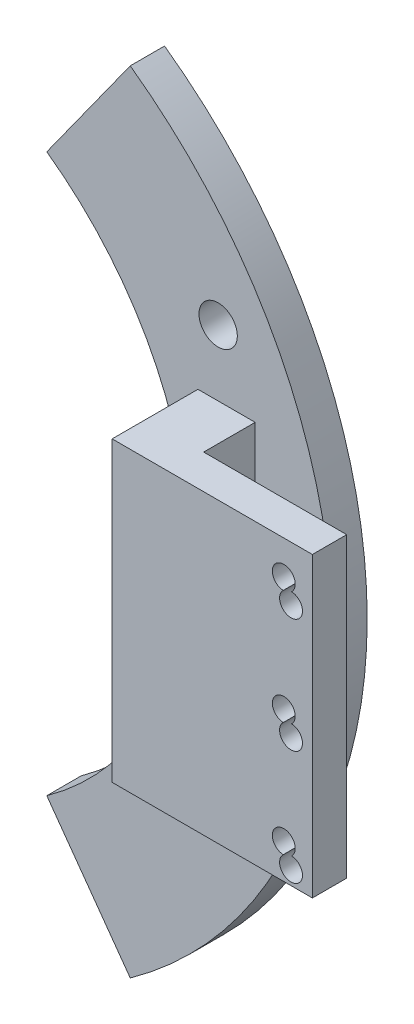
from build123d import *

# Parameters (mm, degrees)
SKETCH_1_R          = 85
SKETCH_1_R_2        = 60
EXTRUDE_1_DEPTH     = 6
SKETCH_2_R          = 3.35
CUT_EXTRUDE_1_DEPTH = 10
SKETCH_3_W          = 10
SKETCH_3_H          = 52
EXTRUDE_2_DEPTH     = 15
SKETCH_8_W          = 8
SKETCH_8_H          = 52
EXTRUDE_3_DEPTH     = 25
SKETCH_10_W         = 6
SKETCH_10_H         = 52
EXTRUDE_4_DEPTH     = 25
SKETCH_11_R         = 2
CUT_EXTRUDE_3_DEPTH = 25
CUT_EXTRUDE_4_DEPTH = 50
SKETCH_6_R          = 2
CUT_EXTRUDE_2_DEPTH = 20


with BuildPart() as part:
    # 草图1 → 凸台-拉伸1 (new body)
    with BuildSketch(Plane.XY):
        Circle(SKETCH_1_R)
        Circle(SKETCH_1_R_2, mode=Mode.SUBTRACT)
    extrude(amount=EXTRUDE_1_DEPTH)

    # 草图2 → 切除-拉伸1 (cut)
    with BuildSketch(Plane.XY.offset(6)):
        with Locations((0, 75)):
            Circle(SKETCH_2_R)
        with Locations((64.951905284, 37.5)):
            Circle(SKETCH_2_R)
        with Locations((64.951905284, -37.5)):
            Circle(SKETCH_2_R)
        with Locations((0, -75)):
            Circle(SKETCH_2_R)
        with Locations((-64.951905284, -37.5)):
            Circle(SKETCH_2_R)
        with Locations((-64.951905284, 37.5)):
            Circle(SKETCH_2_R)
    extrude(amount=-CUT_EXTRUDE_1_DEPTH, mode=Mode.SUBTRACT)

    # 草图3 → 凸台-拉伸2 (add)
    with BuildSketch(Plane.XY.offset(6)):
        with Locations((66.419532829, -0.009729533)):
            Rectangle(SKETCH_3_W, SKETCH_3_H)
        with Locations((-66.419532829, -0.009729533)):
            Rectangle(SKETCH_3_W, SKETCH_3_H)
    extrude(amount=EXTRUDE_2_DEPTH)

    # 草图8 → 凸台-拉伸3 (add)
    with BuildSketch(Plane.ZY.offset(71.419532829)):
        with Locations((17, -0.009729533)):
            Rectangle(SKETCH_8_W, SKETCH_8_H)
    extrude(amount=EXTRUDE_3_DEPTH)

    # 草图10 → 凸台-拉伸4 (add)
    with BuildSketch(Plane(origin=(71.419532829, 0, 0), x_dir=(0, 0, -1), z_dir=(1, 0, 0))):
        with Locations((-18, -0.009729533)):
            Rectangle(SKETCH_10_W, SKETCH_10_H)
    extrude(amount=EXTRUDE_4_DEPTH)

    # 草图11 → 切除-拉伸3 (cut)
    with BuildSketch(Plane.XY.offset(21)):
        with Locations((-91.419532829, 0)):
            Circle(SKETCH_11_R)
        with Locations((-91.419532829, 20)):
            Circle(SKETCH_11_R)
        with Locations(Location((91.419532829, 0, 0), (0, 0, 270))):
            Circle(SKETCH_11_R)
        with Locations(Location((91.419532829, 20, 0), (0, 0, 270))):
            Circle(SKETCH_11_R)
        with Locations((91.419532829, -20)):
            Circle(SKETCH_11_R)
        with Locations(Location((-91.419532829, -20, 0), (0, 0, 270))):
            Circle(SKETCH_11_R)
    extrude(amount=-CUT_EXTRUDE_3_DEPTH, mode=Mode.SUBTRACT)

    # 草图12 → 切除-拉伸4 (cut, symmetric)
    with BuildSketch(Plane.XY.offset(6)):
        with BuildLine():
            Line((35, 48.733971724), (49.583333333, 69.039793276))
            ThreePointArc((49.583333333, 69.039793276), (42.500689847, 73.611761034), (35, 77.459666924))
            Line((35, 77.459666924), (35, 90))
            Line((35, 90), (-35, 90))
            Line((-35, 90), (-133.620495243, 90))
            Line((-133.620495243, 90), (-133.620495243, -90))
            Line((-133.620495243, -90), (-35, -90))
            Line((-35, -90), (35, -90))
            Line((35, -90), (35, -77.459666924))
            ThreePointArc((35, -77.459666924), (42.500689847, -73.611761034), (49.583333333, -69.039793276))
            Line((49.583333333, -69.039793276), (35, -48.733971724))
            Line((35, -48.733971724), (35, 48.733971724))
        make_face()
    extrude(amount=CUT_EXTRUDE_4_DEPTH, both=True, mode=Mode.SUBTRACT)

    # 草图6 → 切除-拉伸2 (cut)
    with BuildSketch(Plane.XY.offset(26)):
        with Locations((92.689735177, -3.459773101)):
            Circle(SKETCH_6_R)
        with Locations((92.689735177, -23.459773101)):
            Circle(SKETCH_6_R)
        with Locations((92.689735177, 16.540226899)):
            Circle(SKETCH_6_R)
        with Locations((-92.689735177, -23.459773101)):
            Circle(SKETCH_6_R)
        with Locations((-92.689735177, -3.459773101)):
            Circle(SKETCH_6_R)
        with Locations((-92.689735177, 16.540226899)):
            Circle(SKETCH_6_R)
    extrude(amount=-CUT_EXTRUDE_2_DEPTH, mode=Mode.SUBTRACT)


solid = part.part
